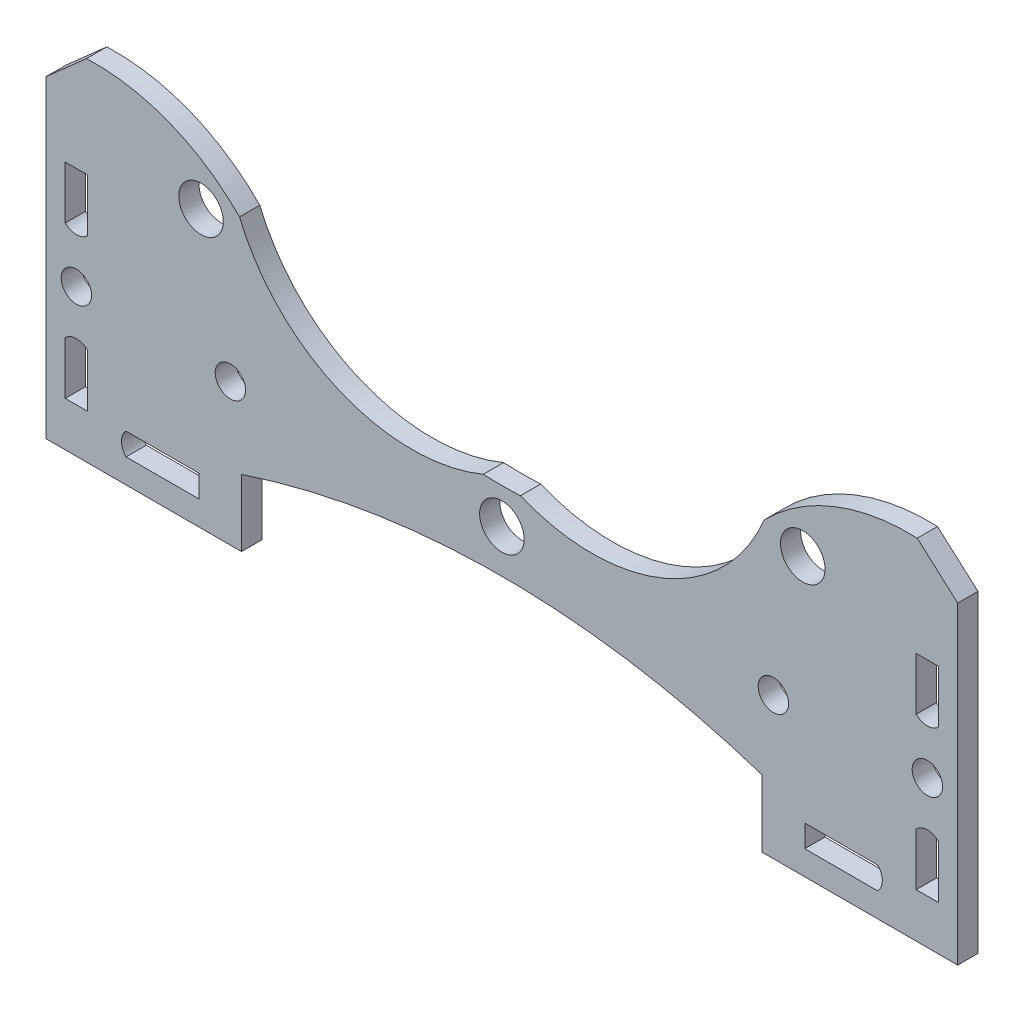
from build123d import *

# Parameters (mm, degrees)
SKETCH_3_R      = 2.2
SKETCH_3_R_2    = 1.5
EXTRUDE_1_DEPTH = 2


with BuildPart() as part:
    # 草图3 → 凸台-拉伸1 (new body)
    with BuildSketch(Plane.XY):
        with BuildLine():
            Line((-41, -4.490216685), (-42, -4.490216685))
            Line((-42, -4.490216685), (-44, -4.490216685))
            Line((-44, -4.490216685), (-45, -4.490216685))
            Line((-45, -4.490216685), (-45, 4.509783315))
            Line((-45, 4.509783315), (-45, 14.509783315))
            Line((-45, 14.509783315), (-45, 26.463053661))
            Line((-45, 26.463053661), (-41, 30.009783315))
            ThreePointArc((-41, 30.009783315), (-32.811469568, 28.6216516), (-25.896750373, 24.021043081))
            ThreePointArc((-25.896750373, 24.021043081), (-15.928379069, 14.053074936), (-1.831258252, 14.053360012))
            ThreePointArc((-1.831258252, 14.053360012), (0, 14.009783315), (1.831258252, 14.053360012))
            ThreePointArc((1.831258252, 14.053360012), (15.928379069, 14.053074936), (25.896750373, 24.021043081))
            ThreePointArc((25.896750373, 24.021043081), (32.811469568, 28.6216516), (41, 30.009783315))
            Line((41, 30.009783315), (45, 26.463053661))
            Line((45, 26.463053661), (45, 14.509783315))
            Line((45, 14.509783315), (45, 4.509783315))
            Line((45, 4.509783315), (45, -4.490216685))
            Line((45, -4.490216685), (41, -4.490216685))
            Line((41, -4.490216685), (25.7, -4.490216685))
            Line((25.7, -4.490216685), (25.7, -0.390216685))
            Line((25.7, -0.390216685), (25.7, 2.109783315))
            ThreePointArc((25.7, 2.109783315), (0, 6.256082772), (-25.7, 2.109783315))
            Line((-25.7, 2.109783315), (-25.7, -0.390216685))
            Line((-25.7, -0.390216685), (-25.7, -4.490216685))
            Line((-25.7, -4.490216685), (-41, -4.490216685))
        make_face()
        with Locations((0, 10.509783315)):
            Circle(SKETCH_3_R, mode=Mode.SUBTRACT)
        with Locations((-29.69848481, 22.811298505)):
            Circle(SKETCH_3_R, mode=Mode.SUBTRACT)
        with Locations((-26.8, 9.509783315)):
            Circle(SKETCH_3_R_2, mode=Mode.SUBTRACT)
        with Locations(Location((26.8, 9.509783315, 0), (0, 0, 180))):
            Circle(SKETCH_3_R_2, mode=Mode.SUBTRACT)
        with Locations((-42, 10.009783315)):
            Circle(SKETCH_3_R_2, mode=Mode.SUBTRACT)
        with Locations(Location((42, 10.009783315, 0), (0, 0, 180))):
            Circle(SKETCH_3_R_2, mode=Mode.SUBTRACT)
        with Locations((29.69848481, 22.811298505)):
            Circle(SKETCH_3_R, mode=Mode.SUBTRACT)
        with BuildLine():
            Line((-37.1, -2.090216685), (-29.9, -2.090216685))
            Line((-29.9, -2.090216685), (-29.9, 0.109783315))
            Line((-29.9, 0.109783315), (-37.1, 0.109783315))
            ThreePointArc((-37.1, 0.109783315), (-37.555634919, -0.990216685), (-37.1, -2.090216685))
        make_face(mode=Mode.SUBTRACT)
        with BuildLine():
            Line((29.9, -2.090216685), (29.9, 0.109783315))
            Line((29.9, 0.109783315), (37.1, 0.109783315))
            ThreePointArc((37.1, 0.109783315), (37.555634919, -0.990216685), (37.1, -2.090216685))
            Line((37.1, -2.090216685), (29.9, -2.090216685))
        make_face(mode=Mode.SUBTRACT)
        with BuildLine():
            Line((-43.1, 5.109783315), (-43.1, -0.090216685))
            Line((-43.1, -0.090216685), (-40.9, -0.090216685))
            Line((-40.9, -0.090216685), (-40.9, 5.109783315))
            ThreePointArc((-40.9, 5.109783315), (-42, 5.565418233), (-43.1, 5.109783315))
        make_face(mode=Mode.SUBTRACT)
        with BuildLine():
            Line((-43.1, 20.109783315), (-40.9, 20.109783315))
            Line((-40.9, 20.109783315), (-40.9, 14.909783315))
            ThreePointArc((-40.9, 14.909783315), (-42, 14.454148396), (-43.1, 14.909783315))
            Line((-43.1, 14.909783315), (-43.1, 20.109783315))
        make_face(mode=Mode.SUBTRACT)
        with BuildLine():
            Line((40.9, 20.109783315), (40.9, 14.909783315))
            ThreePointArc((40.9, 14.909783315), (42, 14.454148396), (43.1, 14.909783315))
            Line((43.1, 14.909783315), (43.1, 20.109783315))
            Line((43.1, 20.109783315), (40.9, 20.109783315))
        make_face(mode=Mode.SUBTRACT)
        with BuildLine():
            Line((40.9, 5.109783315), (40.9, -0.090216685))
            Line((40.9, -0.090216685), (43.1, -0.090216685))
            Line((43.1, -0.090216685), (43.1, 5.109783315))
            ThreePointArc((43.1, 5.109783315), (42, 5.565418233), (40.9, 5.109783315))
        make_face(mode=Mode.SUBTRACT)
    extrude(amount=EXTRUDE_1_DEPTH)


solid = part.part
